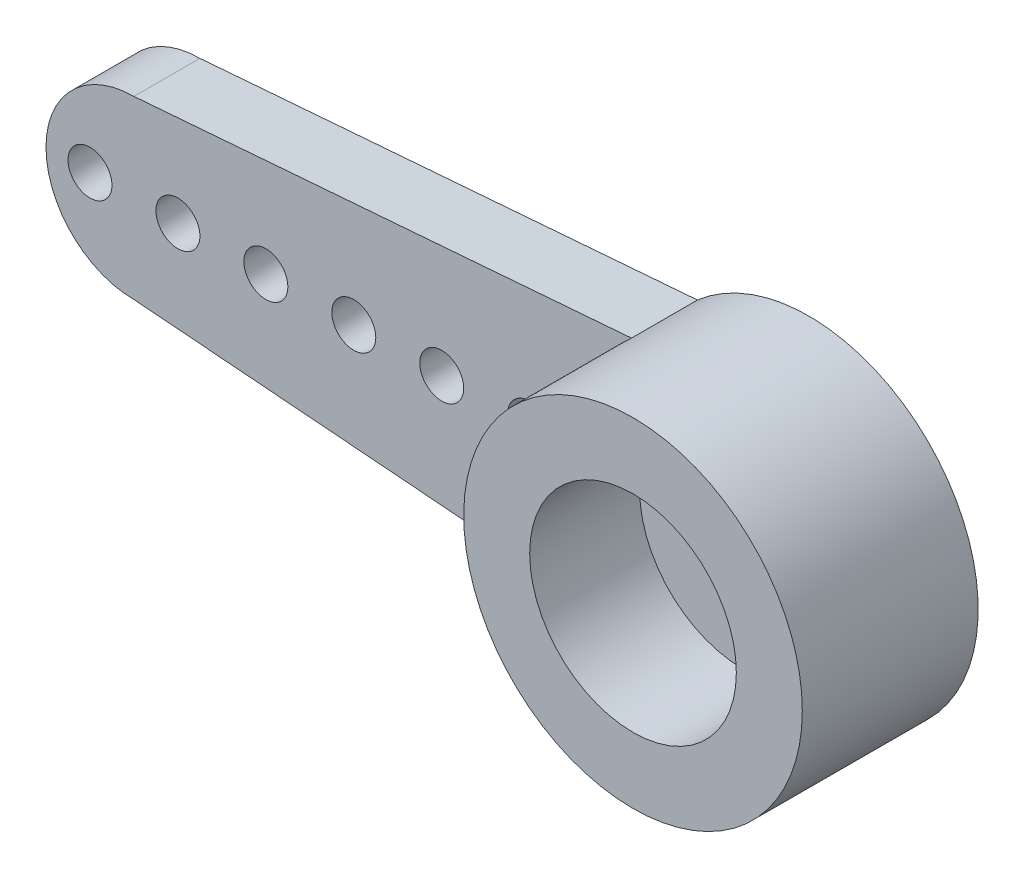
from build123d import *

# Parameters (mm, degrees)
SCHIZZO1_R                   = 3.85
SCHIZZO1_R_2                 = 2.35
ESTRUSIONE_ESTRUSIONE1_DEPTH = 4
ESTRUSIONE_ESTRUSIONE2_DEPTH = 1.5
TAGLIO_ESTRUSIONE1_REACH     = 18.501
SCHIZZO4_R                   = 0.5


with BuildPart() as part:
    # Schizzo1 → Estrusione-Estrusione1 (new body)
    with BuildSketch(Plane.XY):
        Circle(SCHIZZO1_R)
        Circle(SCHIZZO1_R_2, mode=Mode.SUBTRACT)
    extrude(amount=ESTRUSIONE_ESTRUSIONE1_DEPTH)

    # Schizzo3 → Estrusione-Estrusione2 (add)
    with BuildSketch(Plane(origin=(0, 0, 0), x_dir=(-1, 0, 0), z_dir=(0, 0, -1))):
        with BuildLine():
            Line((0, 3.1), (13.85, 2))
            ThreePointArc((13.85, 2), (15.85, 0), (13.85, -2))
            Line((13.85, -2), (0, -3.1))
            ThreePointArc((0, -3.1), (-3.1, 0), (0, 3.1))
        make_face()
    extrude(amount=-ESTRUSIONE_ESTRUSIONE2_DEPTH)

    # Schizzo4 → Taglio-Estrusione1 (cut, up to next)
    with BuildSketch(Plane.XY.offset(1.5), mode=Mode.PRIVATE) as taglio_estrusione1_sk1:
        with Locations((-4.85, 0)):
            Circle(SCHIZZO4_R)
    taglio_estrusione1_tool1 = extrude(taglio_estrusione1_sk1.sketch, amount=-TAGLIO_ESTRUSIONE1_REACH, mode=Mode.PRIVATE) & part.part
    # Schizzo4 → Taglio-Estrusione1 (cut, up to next)
    with BuildSketch(Plane.XY.offset(1.5), mode=Mode.PRIVATE) as taglio_estrusione1_sk2:
        with Locations((-6.85, 0)):
            Circle(SCHIZZO4_R)
    taglio_estrusione1_tool2 = extrude(taglio_estrusione1_sk2.sketch, amount=-TAGLIO_ESTRUSIONE1_REACH, mode=Mode.PRIVATE) & part.part
    # Schizzo4 → Taglio-Estrusione1 (cut, up to next)
    with BuildSketch(Plane.XY.offset(1.5), mode=Mode.PRIVATE) as taglio_estrusione1_sk3:
        with Locations((-8.85, 0)):
            Circle(SCHIZZO4_R)
    taglio_estrusione1_tool3 = extrude(taglio_estrusione1_sk3.sketch, amount=-TAGLIO_ESTRUSIONE1_REACH, mode=Mode.PRIVATE) & part.part
    # Schizzo4 → Taglio-Estrusione1 (cut, up to next)
    with BuildSketch(Plane.XY.offset(1.5), mode=Mode.PRIVATE) as taglio_estrusione1_sk4:
        with Locations((-10.85, 0)):
            Circle(SCHIZZO4_R)
    taglio_estrusione1_tool4 = extrude(taglio_estrusione1_sk4.sketch, amount=-TAGLIO_ESTRUSIONE1_REACH, mode=Mode.PRIVATE) & part.part
    # Schizzo4 → Taglio-Estrusione1 (cut, up to next)
    with BuildSketch(Plane.XY.offset(1.5), mode=Mode.PRIVATE) as taglio_estrusione1_sk5:
        with Locations((-12.85, 0)):
            Circle(SCHIZZO4_R)
    taglio_estrusione1_tool5 = extrude(taglio_estrusione1_sk5.sketch, amount=-TAGLIO_ESTRUSIONE1_REACH, mode=Mode.PRIVATE) & part.part
    # Schizzo4 → Taglio-Estrusione1 (cut, up to next)
    with BuildSketch(Plane.XY.offset(1.5), mode=Mode.PRIVATE) as taglio_estrusione1_sk6:
        with Locations((-14.85, 0)):
            Circle(SCHIZZO4_R)
    taglio_estrusione1_tool6 = extrude(taglio_estrusione1_sk6.sketch, amount=-TAGLIO_ESTRUSIONE1_REACH, mode=Mode.PRIVATE) & part.part
    add(taglio_estrusione1_tool1.solids().sort_by_distance((-4.85, 0, 1.5))[0], mode=Mode.SUBTRACT)
    add(taglio_estrusione1_tool2.solids().sort_by_distance((-6.85, 0, 1.5))[0], mode=Mode.SUBTRACT)
    add(taglio_estrusione1_tool3.solids().sort_by_distance((-8.85, 0, 1.5))[0], mode=Mode.SUBTRACT)
    add(taglio_estrusione1_tool4.solids().sort_by_distance((-10.85, 0, 1.5))[0], mode=Mode.SUBTRACT)
    add(taglio_estrusione1_tool5.solids().sort_by_distance((-12.85, 0, 1.5))[0], mode=Mode.SUBTRACT)
    add(taglio_estrusione1_tool6.solids().sort_by_distance((-14.85, 0, 1.5))[0], mode=Mode.SUBTRACT)


solid = part.part
